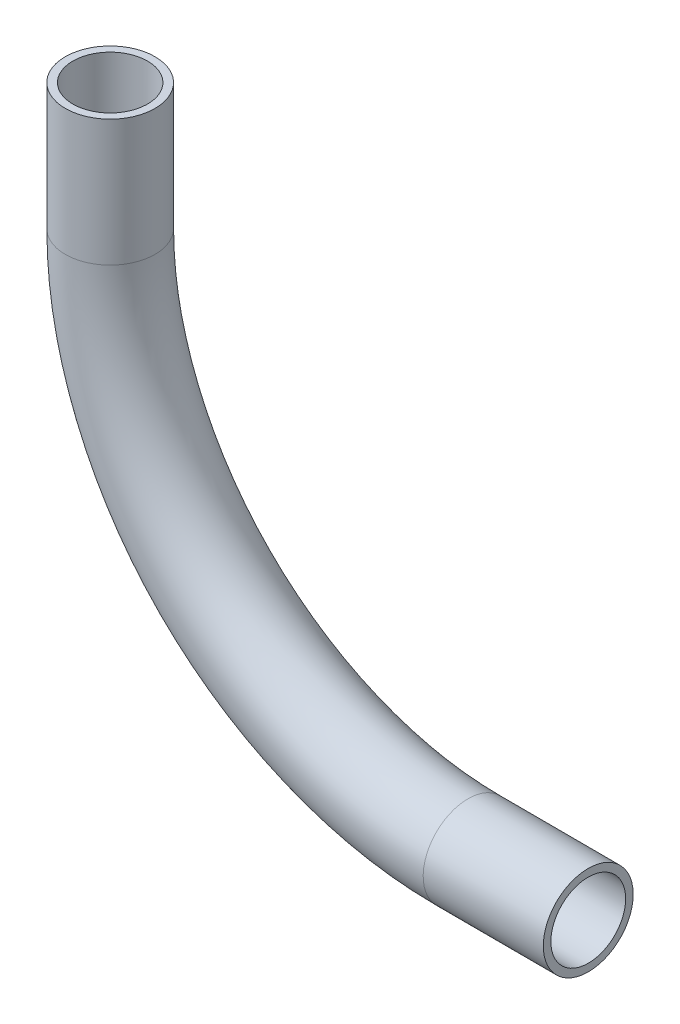
from build123d import *

# Parameters (mm, degrees)
SKETCH1_R                 = 6.35
SKETCH1_R_2               = 5.2832
PIPE_0_5_SCH_40_1_DEPTH   = 17.900997827
SKETCH1_ON_SEGMENT_2_R    = 6.35
SKETCH1_ON_SEGMENT_2_R_2  = 5.2832
PIPE_0_5_SCH_40_1_2_ANGLE = 90
SKETCH1_ON_SEGMENT_3_R    = 6.35
SKETCH1_ON_SEGMENT_3_R_2  = 5.2832
PIPE_0_5_SCH_40_1_3_DEPTH = 17.04872038


with BuildPart() as part:
    # Sketch1 → Pipe 0.5 SCH 40(1) (new body)
    with BuildSketch(Plane(origin=(44.524118781, -643.315396514, 354.927728694), x_dir=(1, 0, 0), z_dir=(0, -1, 0))):
        Circle(SKETCH1_R)
        Circle(SKETCH1_R_2, mode=Mode.SUBTRACT)
    extrude(amount=PIPE_0_5_SCH_40_1_DEPTH)


with BuildPart() as body_2:
    # Sketch1 on segment 2 (carried to the start of arc 2) → Pipe 0.5 SCH 40_1 2 (revolve)
    with BuildSketch(Plane(origin=(44.524118781, -661.216394341, 354.927728694), x_dir=(1, 0, 0), z_dir=(0, -1, 0))):
        Circle(SKETCH1_ON_SEGMENT_2_R)
        Circle(SKETCH1_ON_SEGMENT_2_R_2, mode=Mode.SUBTRACT)
    revolve(axis=Axis((95.323978696, -661.216394341, 355.047029303), (-0.002348437, 0, 0.999997242)), revolution_arc=PIPE_0_5_SCH_40_1_2_ANGLE)


with BuildPart() as body_3:
    # Sketch1 on segment 3 (carried to segment 3) → Pipe 0.5 SCH 40_1 3 (new body)
    with BuildSketch(Plane(origin=(95.323978696, -712.016394341, 355.047029303), x_dir=(5.515e-06, 0.999997242, -0.002348431), z_dir=(0.999997242, 0, 0.002348437))):
        Circle(SKETCH1_ON_SEGMENT_3_R)
        Circle(SKETCH1_ON_SEGMENT_3_R_2, mode=Mode.SUBTRACT)
    extrude(amount=PIPE_0_5_SCH_40_1_3_DEPTH)


with BuildPart() as part_1:
    add(part.part)

    # Pipe 0.5 SCH 40(1) as one body: union body 2, body 3
    add(body_2.part)
    add(body_3.part)


solid = part_1.part
